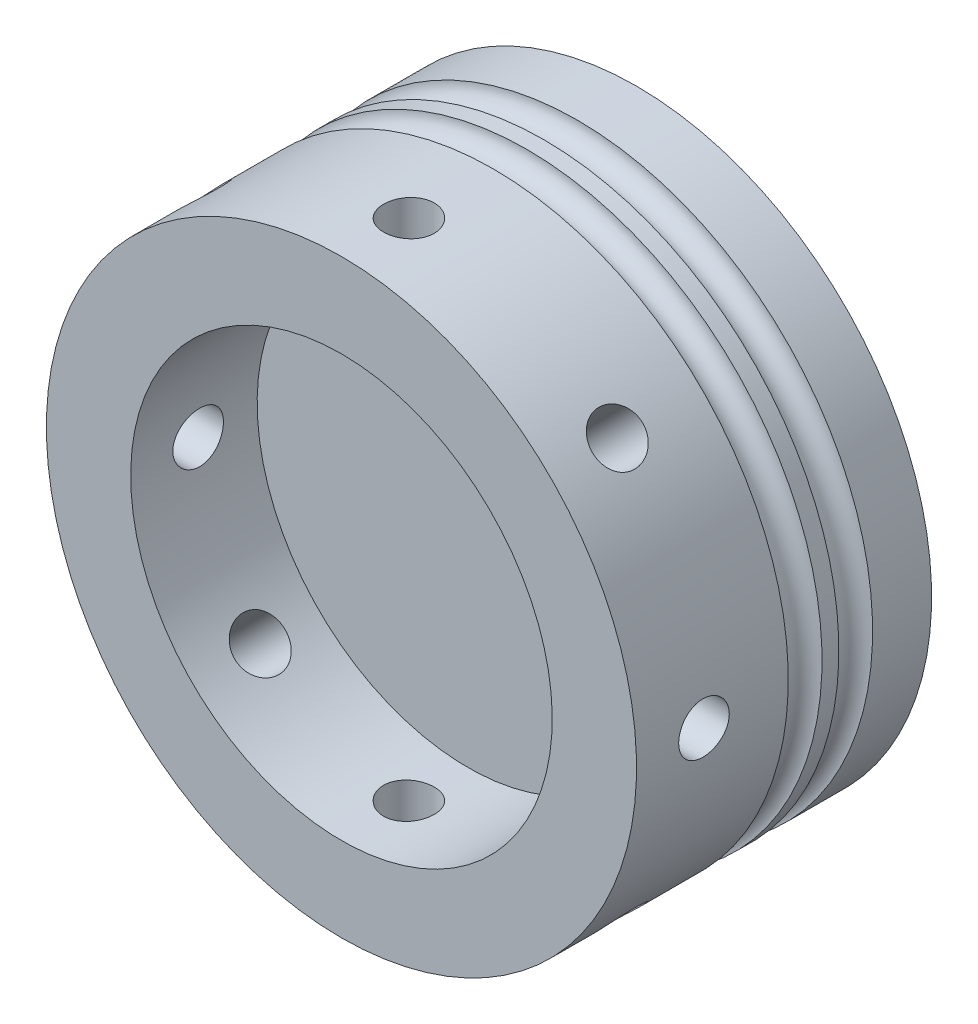
from build123d import *

# Parameters (mm, degrees)
SKETCH2_R          = 3
CUT_EXTRUDE3_DEPTH = 12.5
CIRPATTERN1_COUNT  = 8


with BuildPart() as part:
    # Sketch1 → Revolve1 (revolve)
    with BuildSketch(Plane(origin=(0, 0, 0), x_dir=(0, 0, -1), z_dir=(1, 0, 0)), mode=Mode.PRIVATE) as revolve1_sk:
        with BuildLine():
            Line((0, 0), (0, -10))
            Line((0, -10), (18, -10))
            ThreePointArc((18, -10), (20, -8), (22, -10))
            Line((22, -10), (24, -10))
            ThreePointArc((24, -10), (26, -8), (28, -10))
            Line((28, -10), (35, -10))
            Line((35, -10), (35, 25))
            Line((35, 25), (15, 25))
            Line((15, 25), (15, 0))
            Line((15, 0), (0, 0))
        make_face()
    revolve(revolve1_sk.sketch.rotate(Axis((0, 25, -35), (0, 0, 1)), 180), axis=Axis((0, 25, -35), (0, 0, 1)))

    # Sketch2 → Cut-Extrude3 (cut, symmetric)
    with BuildSketch(Plane(origin=(0, 0, 0), x_dir=(1, 0, 0), z_dir=(0, 1, 0))):
        with Locations(Location((0, 8, 0), (0, 0, 270))):
            Circle(SKETCH2_R)
    cut_extrude3 = extrude(amount=CUT_EXTRUDE3_DEPTH, both=True, mode=Mode.SUBTRACT)

    # CirPattern1: Cut-Extrude3 ×8 about axis
    cirpattern1_axis = Axis((0, 25, -35), (0, 0, -1))
    for i in range(1, CIRPATTERN1_COUNT):
        add(cut_extrude3.rotate(cirpattern1_axis, i * 360 / CIRPATTERN1_COUNT), mode=Mode.SUBTRACT)


solid = part.part
